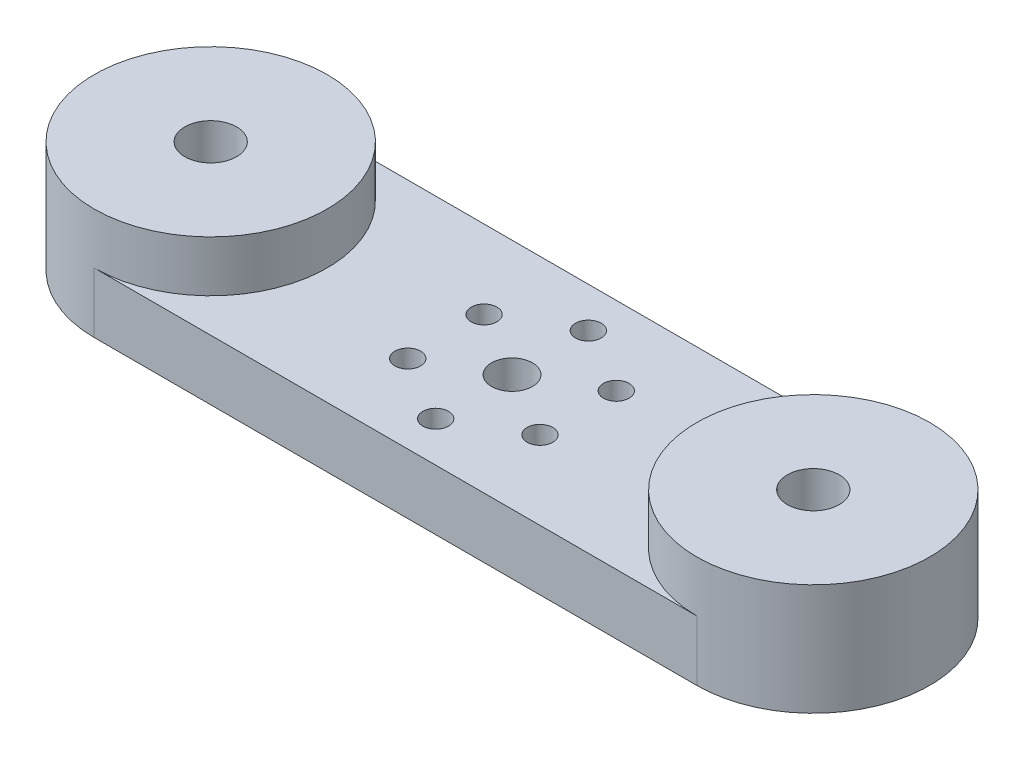
from build123d import *

# Parameters (mm, degrees)
SKETCH1_R            = 2.55
BOSS_EXTRUDE1_DEPTH  = 7.5
BOSS_EXTRUDE2_START  = 6.35
SKETCH1_3_R          = 14.5
SKETCH1_3_R_2        = 3.225
BOSS_EXTRUDE2_DEPTH  = 6.35
M3_CLEARANCE_HOLE1_D = 3.2


with BuildPart() as part:
    # Sketch1 → Boss-Extrude1 (new body)
    with BuildSketch(Plane(origin=(0, 0, 0), x_dir=(1, 0, 0), z_dir=(0, 1, 0))):
        with BuildLine():
            Line((37.5, 14.5), (-37.5, 14.5))
            ThreePointArc((-37.5, 14.5), (-52, 0), (-37.5, -14.5))
            Line((-37.5, -14.5), (37.5, -14.5))
            ThreePointArc((37.5, -14.5), (52, 0), (37.5, 14.5))
        make_face()
        Circle(SKETCH1_R, mode=Mode.SUBTRACT)
    extrude(amount=-BOSS_EXTRUDE1_DEPTH)

    # Sketch1<3> → Boss-Extrude2 (add)
    # profile 1 of 2: a face of its own
    with BuildSketch(Plane(origin=(0, 0, 0), x_dir=(1, 0, 0), z_dir=(0, 1, 0)).offset(BOSS_EXTRUDE2_START)):
        with Locations((-37.5, 0)):
            Circle(SKETCH1_3_R)
        with Locations((-37.5, 0)):
            Circle(SKETCH1_3_R_2, mode=Mode.SUBTRACT)
    # profile 2 of 2: a face of its own
    with BuildSketch(Plane(origin=(0, 0, 0), x_dir=(1, 0, 0), z_dir=(0, 1, 0)).offset(BOSS_EXTRUDE2_START)):
        with Locations((37.5, 0)):
            Circle(SKETCH1_3_R)
        with Locations((37.5, 0)):
            Circle(SKETCH1_3_R_2, mode=Mode.SUBTRACT)
    extrude(amount=-BOSS_EXTRUDE2_DEPTH)

    # M3 Clearance Hole1 (through all)
    with Locations(Plane(origin=(-8.227241336, 0, -4.75), x_dir=(0, 0, 1), z_dir=(0, 1, 0))):
        with Locations((0, 0), (-4.75, 8.227241336), (0, 16.454482672), (9.5, 0), (9.5, 16.454482672), (14.25, 8.227241336)):
            Hole(M3_CLEARANCE_HOLE1_D / 2)


solid = part.part
